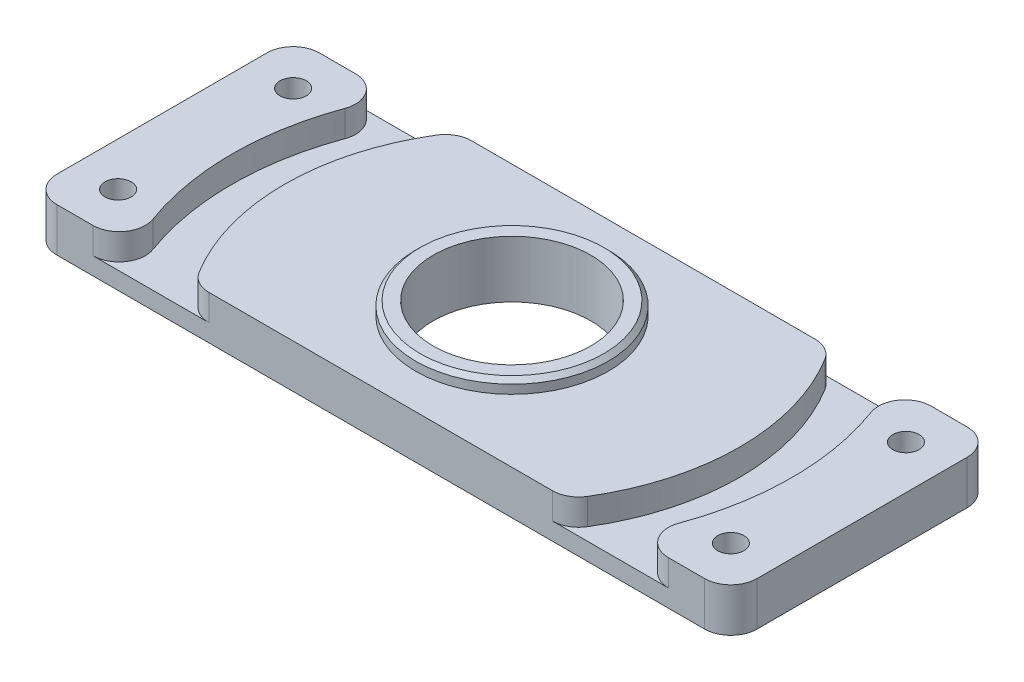
from build123d import *

# Parameters (mm, degrees)
SKETCH_1_W          = 80
SKETCH_1_H          = 30
SKETCH_1_R          = 9
EXTRUDE_1_DEPTH     = 5
EXTRUDE_START       = 1.5
SKETCH_4_R          = 11
SKETCH_4_R_2        = 9
EXTRUDE_4_DEPTH     = 1.5
SKETCH_5_R          = 32
SKETCH_5_R_2        = 26
CUT_EXTRUDE_1_DEPTH = 3
SKETCH_8_R          = 1.5
CUT_EXTRUDE_2_DEPTH = 10
FILLET_1_R          = 3
CHAMFER_1_SIZE      = 0.5


with BuildPart() as part:
    # 草图1 → 凸台-拉伸1 (new body)
    with BuildSketch(Plane(origin=(0, 0, 0), x_dir=(1, 0, 0), z_dir=(0, 1, 0))):
        Rectangle(SKETCH_1_W, SKETCH_1_H)
        with Locations(Location((0, 0, 0), (0, 0, 270))):
            Circle(SKETCH_1_R, mode=Mode.SUBTRACT)
    extrude(amount=-EXTRUDE_1_DEPTH)

    # 草图4 → 凸台-拉伸4 (add)
    with BuildSketch(Plane(origin=(0, 0, 0), x_dir=(1, 0, 0), z_dir=(0, 1, 0)).offset(EXTRUDE_START)):
        with Locations(Location((0, 0, 0), (0, 0, 270))):
            Circle(SKETCH_4_R)
        with Locations(Location((0, 0, 0), (0, 0, 270))):
            Circle(SKETCH_4_R_2, mode=Mode.SUBTRACT)
    extrude(amount=-EXTRUDE_4_DEPTH)

    # 草图5 → 切除-拉伸1 (cut)
    with BuildSketch(Plane(origin=(0, 0, 0), x_dir=(1, 0, 0), z_dir=(0, 1, 0))):
        Circle(SKETCH_5_R)
        Circle(SKETCH_5_R_2, mode=Mode.SUBTRACT)
    extrude(amount=-CUT_EXTRUDE_1_DEPTH, mode=Mode.SUBTRACT)

    # 草图8 → 切除-拉伸2 (cut)
    with BuildSketch(Plane.XZ.offset(5)):
        with Locations(Location((35, 10, 0), (0, 0, 270))):
            Circle(SKETCH_8_R)
        with Locations(Location((35, -10, 0), (0, 0, 270))):
            Circle(SKETCH_8_R)
        with Locations(Location((-35, -10, 0), (0, 0, 90))):
            Circle(SKETCH_8_R)
        with Locations(Location((-35, 10, 0), (0, 0, 90))):
            Circle(SKETCH_8_R)
    extrude(amount=-CUT_EXTRUDE_2_DEPTH, mode=Mode.SUBTRACT)

    # 圆角1
    fillet_1_edges = [part.edges().sort_by_distance(p)[0] for p in [
        (28.26658805, -1.5, 15),
        (-28.26658805, -1.5, 15),
        (-28.26658805, -1.5, -15),
        (28.26658805, -1.5, -15),
        (21.236760582, -1.5, 15),
        (21.236760582, -1.5, -15),
        (-21.236760582, -1.5, 15),
        (-21.236760582, -1.5, -15),
        (40, -2.5, 15),
        (-40, -2.5, 15),
        (-40, -2.5, -15),
        (40, -2.5, -15),
    ]]
    fillet(fillet_1_edges, radius=FILLET_1_R)

    # 倒角1
    chamfer_1_edges = [part.edges().sort_by_distance(p)[0] for p in [
        (0, 1.5, -11),
    ]]
    chamfer(chamfer_1_edges, length=CHAMFER_1_SIZE)


solid = part.part
